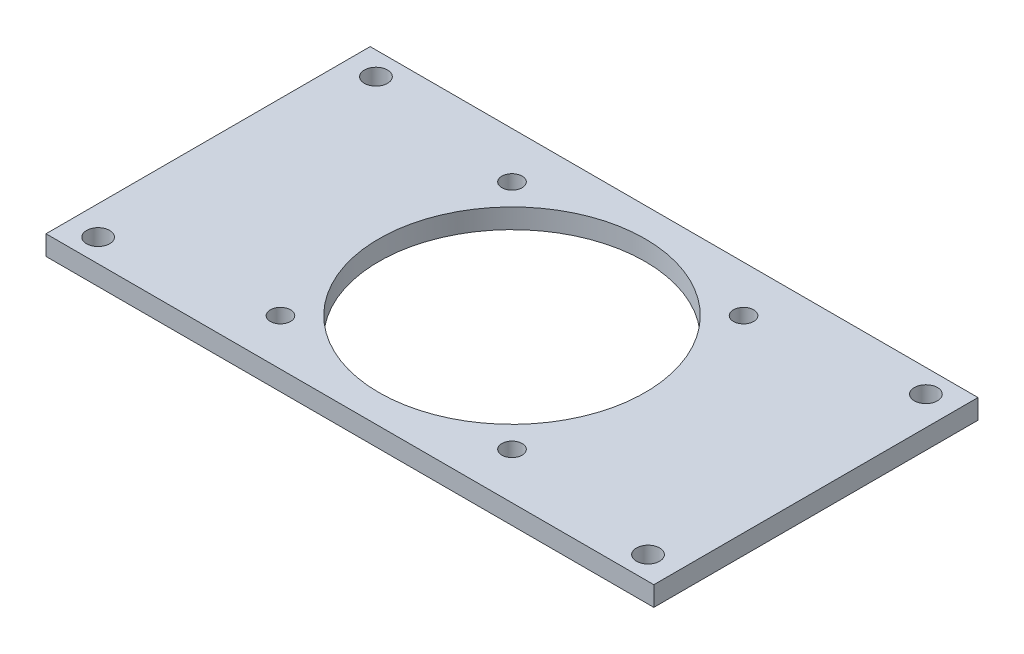
from build123d import *

# Parameters (mm, degrees)
SKETCH1_R           = 2.2225
BOSS_EXTRUDE1_DEPTH = 4.318


with BuildPart() as part:
    # Sketch1 → Boss-Extrude1 (new body)
    with BuildSketch(Plane(origin=(0, 0, 0), x_dir=(1, 0, 0), z_dir=(0, 1, 0))):
        Polygon((66.675, 35.56), (0, 35.56), (-66.675, 35.56), (-66.675, -35.56), (66.675, -35.56), align=None)
        with BuildLine():
            ThreePointArc((-57.785, -30.48), (-62.121051224, -32.276051224), (-60.325, -27.94))
            ThreePointArc((-60.325, -27.94), (-58.528948776, -28.683948776), (-57.785, -30.48))
        make_face(mode=Mode.SUBTRACT)
        with Locations((-25.4, -25.4)):
            Circle(SKETCH1_R, mode=Mode.SUBTRACT)
        with Locations((25.4, -25.4)):
            Circle(SKETCH1_R, mode=Mode.SUBTRACT)
        with BuildLine():
            ThreePointArc((62.865, -30.48), (58.528948776, -32.276051224), (60.325, -27.94))
            ThreePointArc((60.325, -27.94), (62.121051224, -28.683948776), (62.865, -30.48))
        make_face(mode=Mode.SUBTRACT)
        with BuildLine():
            ThreePointArc((29.21, 0), (0, -29.21), (-29.21, 0))
            ThreePointArc((-29.21, 0), (0, 29.21), (29.21, 0))
        make_face(mode=Mode.SUBTRACT)
        with BuildLine():
            ThreePointArc((-57.785, 30.48), (-58.528948776, 28.683948776), (-60.325, 27.94))
            ThreePointArc((-60.325, 27.94), (-62.121051224, 32.276051224), (-57.785, 30.48))
        make_face(mode=Mode.SUBTRACT)
        with Locations((-25.4, 25.4)):
            Circle(SKETCH1_R, mode=Mode.SUBTRACT)
        with Locations((25.4, 25.4)):
            Circle(SKETCH1_R, mode=Mode.SUBTRACT)
        with BuildLine():
            ThreePointArc((62.865, 30.48), (62.121051224, 28.683948776), (60.325, 27.94))
            ThreePointArc((60.325, 27.94), (58.528948776, 32.276051224), (62.865, 30.48))
        make_face(mode=Mode.SUBTRACT)
    extrude(amount=BOSS_EXTRUDE1_DEPTH)


solid = part.part
